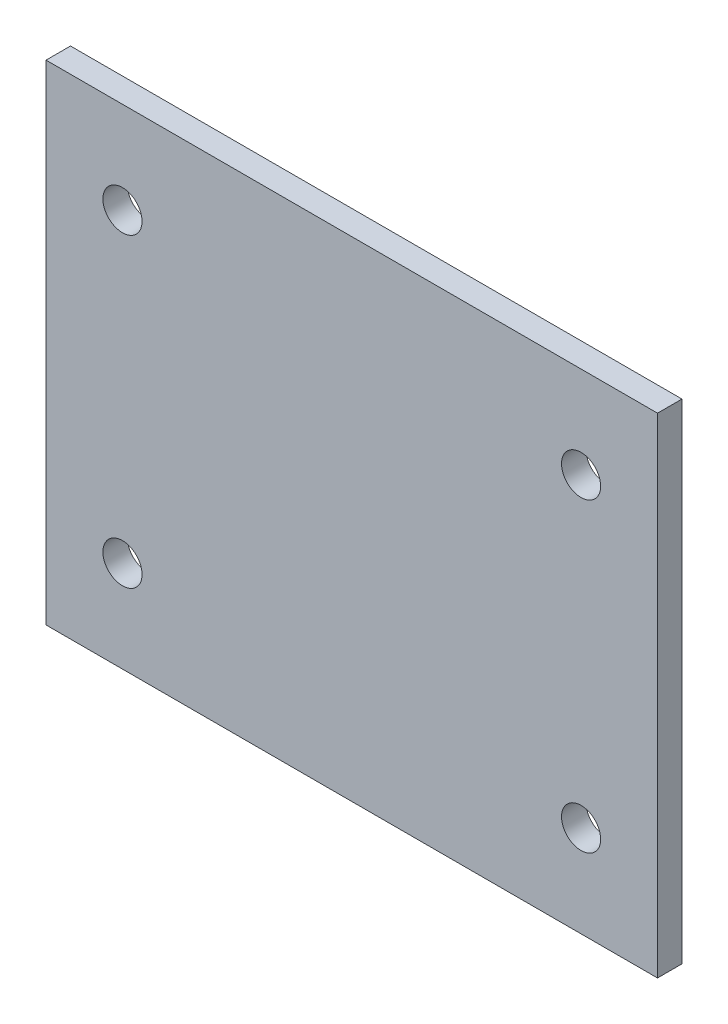
from build123d import *

# Parameters (mm, degrees)
SCHIZZO1_W                   = 100
SCHIZZO1_H                   = 80
SCHIZZO1_R                   = 3.2
ESTRUSIONE_ESTRUSIONE1_DEPTH = 4


with BuildPart() as part:
    # Schizzo1 → Estrusione-Estrusione1 (new body)
    with BuildSketch(Plane.XY):
        Rectangle(SCHIZZO1_W, SCHIZZO1_H)
        with Locations((-37.5, 25)):
            Circle(SCHIZZO1_R, mode=Mode.SUBTRACT)
        with Locations((37.5, 25)):
            Circle(SCHIZZO1_R, mode=Mode.SUBTRACT)
        with Locations((37.5, -25)):
            Circle(SCHIZZO1_R, mode=Mode.SUBTRACT)
        with Locations((-37.5, -25)):
            Circle(SCHIZZO1_R, mode=Mode.SUBTRACT)
    extrude(amount=ESTRUSIONE_ESTRUSIONE1_DEPTH)


solid = part.part
